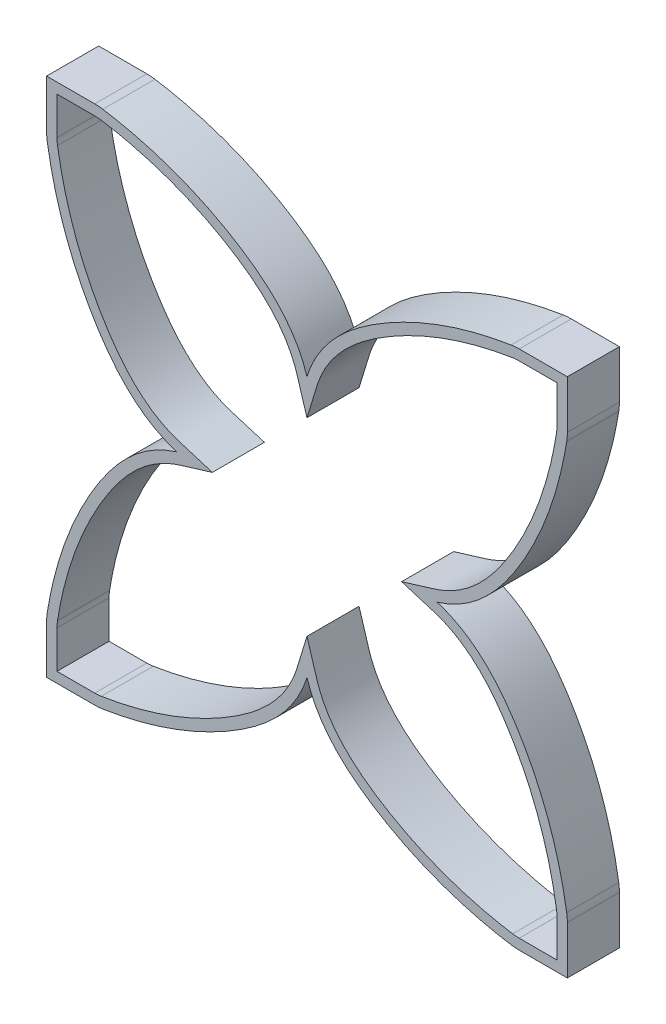
from build123d import *

# Parameters (mm, degrees)
BOSS_EXTRUDE1_DEPTH = 10


with BuildPart() as part:
    # Sketch1 → Boss-Extrude1 (new body)
    with BuildSketch(Plane.XY):
        with BuildLine():
            Line((0, 0), (0, -9.242053945))
            ThreePointArc((0, -9.242053945), (0.030694057, -10.024958163), (0.122587803, -10.80305628))
            add(Edge.make_bspline(
                [(0.122587803, -10.80305628), (0.685908358, -14.367528415), (2.7114907, -23.140292662), (9.284416492, -37.987291491), (17.801165023, -47.794657347), (25, -50)],
                knots=[0.016475851, 0.016475851, 0.016475851, 0.016475851, 0.236061139, 0.56358454, 1, 1, 1, 1], degree=3))
            add(Edge.make_bspline(
                [(0.122587803, -89.19694372), (0.685908358, -85.632471585), (2.7114907, -76.859707338), (9.284416492, -62.012708509), (17.801165023, -52.205342653), (25, -50)],
                knots=[0.016475851, 0.016475851, 0.016475851, 0.016475851, 0.236061139, 0.56358454, 1, 1, 1, 1], degree=3))
            ThreePointArc((0.122587803, -89.19694372), (0.030694057, -89.975041837), (0, -90.757946055))
            Line((0, -90.757946055), (0, -100))
            Line((0, -100), (9.242053945, -100))
            ThreePointArc((9.242053945, -100), (10.024958163, -99.969305943), (10.80305628, -99.877412197))
            add(Edge.make_bspline(
                [(10.80305628, -99.877412197), (14.367528415, -99.314091642), (23.140292662, -97.2885093), (37.987291491, -90.715583508), (47.794657347, -82.198834977), (50, -75)],
                knots=[0.016475851, 0.016475851, 0.016475851, 0.016475851, 0.236061139, 0.56358454, 1, 1, 1, 1], degree=3))
            add(Edge.make_bspline(
                [(89.19694372, -99.877412197), (85.632471585, -99.314091642), (76.859707338, -97.2885093), (62.012708509, -90.715583508), (52.205342653, -82.198834977), (50, -75)],
                knots=[0.016475851, 0.016475851, 0.016475851, 0.016475851, 0.236061139, 0.56358454, 1, 1, 1, 1], degree=3))
            ThreePointArc((89.19694372, -99.877412197), (89.975041837, -99.969305943), (90.757946055, -100))
            Line((90.757946055, -100), (100, -100))
            Line((100, -100), (100, -90.757946055))
            ThreePointArc((100, -90.757946055), (99.969305943, -89.975041837), (99.877412197, -89.19694372))
            add(Edge.make_bspline(
                [(99.877412197, -89.19694372), (99.314091642, -85.632471585), (97.2885093, -76.859707338), (90.715583508, -62.012708509), (82.198834977, -52.205342653), (75, -50)],
                knots=[0.016475851, 0.016475851, 0.016475851, 0.016475851, 0.236061139, 0.56358454, 1, 1, 1, 1], degree=3))
            add(Edge.make_bspline(
                [(99.877412197, -10.80305628), (99.314091642, -14.367528415), (97.2885093, -23.140292662), (90.715583508, -37.987291491), (82.198834977, -47.794657347), (75, -50)],
                knots=[0.016475851, 0.016475851, 0.016475851, 0.016475851, 0.236061139, 0.56358454, 1, 1, 1, 1], degree=3))
            ThreePointArc((99.877412197, -10.80305628), (99.969305943, -10.024958163), (100, -9.242053945))
            Line((100, -9.242053945), (100, 0))
            Line((100, 0), (90.757946055, 0))
            ThreePointArc((90.757946055, 0), (89.975041837, -0.030694057), (89.19694372, -0.122587803))
            add(Edge.make_bspline(
                [(89.19694372, -0.122587803), (85.632471585, -0.685908358), (76.859707338, -2.7114907), (62.012708509, -9.284416492), (52.205342653, -17.801165023), (50, -25)],
                knots=[0.016475851, 0.016475851, 0.016475851, 0.016475851, 0.236061139, 0.56358454, 1, 1, 1, 1], degree=3))
            add(Edge.make_bspline(
                [(10.80305628, -0.122587803), (14.367528415, -0.685908358), (23.140292662, -2.7114907), (37.987291491, -9.284416492), (47.794657347, -17.801165023), (50, -25)],
                knots=[0.016475851, 0.016475851, 0.016475851, 0.016475851, 0.236061139, 0.56358454, 1, 1, 1, 1], degree=3))
            ThreePointArc((10.80305628, -0.122587803), (10.024958163, -0.030694057), (9.242053945, 0))
            Line((9.242053945, 0), (0, 0))
        make_face()
        with BuildLine():
            Line((2, -2), (2, -9.242053945))
            ThreePointArc((2, -9.242053945), (2.024555246, -9.868377319), (2.098070242, -10.490855813))
            add(Edge.make_bspline(
                [(2.098070242, -10.490855813), (2.444069582, -12.680204302), (3.331669001, -17.035127547), (5.260019869, -23.389259646), (7.801434381, -29.513351974), (10.983024362, -35.372937491), (14.149232999, -39.905993359), (17.059278881, -43.020986867), (19.451173969, -45.049833404), (21.641453827, -46.441127237), (23.523341165, -47.350065483), (24.64770741, -47.784131695), (25.405341697, -48.033067811), (25.957829229, -48.201321168), (26.970970181, -48.51231476), (28.964189392, -49.122480359), (30.683998781, -49.649532559), (31.828019312, -50)],
                knots=[0.016475851, 0.016475851, 0.016475851, 0.016475851, 0.155183919, 0.293891987, 0.432600055, 0.571308123, 0.710016191, 0.779370225, 0.848724259, 0.918078293, 0.95275531, 0.987432327, 0.996101581, 1.004770835, 1.022109344, 1.056786361, 1.126140395, 1.126140395, 1.126140395, 1.126140395], degree=3))
            add(Edge.make_bspline(
                [(31.828019312, -50), (30.683998781, -50.350467441), (28.964189392, -50.877519641), (26.970970181, -51.48768524), (25.957829229, -51.798678832), (25.405341697, -51.966932189), (24.64770741, -52.215868305), (23.523341165, -52.649934517), (21.641453827, -53.558872763), (19.451173969, -54.950166596), (17.059278881, -56.979013133), (14.149232999, -60.094006641), (10.983024362, -64.627062509), (7.801434381, -70.486648026), (5.260019869, -76.610740354), (3.331669001, -82.964872453), (2.444069582, -87.319795698), (2.098070242, -89.509144187)],
                knots=[0.016475851, 0.016475851, 0.016475851, 0.016475851, 0.085829885, 0.120506902, 0.13784541, 0.146514664, 0.155183919, 0.189860936, 0.224537953, 0.293891987, 0.363246021, 0.432600055, 0.571308123, 0.710016191, 0.848724259, 0.987432327, 1.126140395, 1.126140395, 1.126140395, 1.126140395], degree=3))
            ThreePointArc((2.098070242, -89.509144187), (2.024555246, -90.131622681), (2, -90.757946055))
            Line((2, -90.757946055), (2, -98))
            Line((2, -98), (9.242053945, -98))
            ThreePointArc((9.242053945, -98), (9.868377319, -97.975444754), (10.490855813, -97.901929758))
            add(Edge.make_bspline(
                [(10.490855813, -97.901929758), (12.680204302, -97.555930418), (17.035127547, -96.668330999), (23.389259646, -94.739980131), (29.513351974, -92.198565619), (35.372937491, -89.016975638), (39.905993359, -85.850767001), (43.020986867, -82.940721119), (45.049833404, -80.548826031), (46.441127237, -78.358546173), (47.350065483, -76.476658835), (47.784131695, -75.35229259), (48.033067811, -74.594658303), (48.201321168, -74.042170771), (48.51231476, -73.029029819), (49.122480359, -71.035810608), (49.649532559, -69.316001219), (50, -68.171980688)],
                knots=[0.016475851, 0.016475851, 0.016475851, 0.016475851, 0.155183919, 0.293891987, 0.432600055, 0.571308123, 0.710016191, 0.779370225, 0.848724259, 0.918078293, 0.95275531, 0.987432327, 0.996101581, 1.004770835, 1.022109344, 1.056786361, 1.126140395, 1.126140395, 1.126140395, 1.126140395], degree=3))
            add(Edge.make_bspline(
                [(50, -68.171980688), (50.350467441, -69.316001219), (50.877519641, -71.035810608), (51.48768524, -73.029029819), (51.798678832, -74.042170771), (51.966932189, -74.594658303), (52.215868305, -75.35229259), (52.649934517, -76.476658835), (53.558872763, -78.358546173), (54.950166596, -80.548826031), (56.979013133, -82.940721119), (60.094006641, -85.850767001), (64.627062509, -89.016975638), (70.486648026, -92.198565619), (76.610740354, -94.739980131), (82.964872453, -96.668330999), (87.319795698, -97.555930418), (89.509144187, -97.901929758)],
                knots=[0.016475851, 0.016475851, 0.016475851, 0.016475851, 0.085829885, 0.120506902, 0.13784541, 0.146514664, 0.155183919, 0.189860936, 0.224537953, 0.293891987, 0.363246021, 0.432600055, 0.571308123, 0.710016191, 0.848724259, 0.987432327, 1.126140395, 1.126140395, 1.126140395, 1.126140395], degree=3))
            ThreePointArc((89.509144187, -97.901929758), (90.131622681, -97.975444754), (90.757946055, -98))
            Line((90.757946055, -98), (98, -98))
            Line((98, -98), (98, -90.757946055))
            ThreePointArc((98, -90.757946055), (97.975444754, -90.131622681), (97.901929758, -89.509144187))
            add(Edge.make_bspline(
                [(97.901929758, -89.509144187), (97.555930418, -87.319795698), (96.668330999, -82.964872453), (94.739980131, -76.610740354), (92.198565619, -70.486648026), (89.016975638, -64.627062509), (85.850767001, -60.094006641), (82.940721119, -56.979013133), (80.548826031, -54.950166596), (78.358546173, -53.558872763), (76.476658835, -52.649934517), (75.35229259, -52.215868305), (74.594658303, -51.966932189), (74.042170771, -51.798678832), (73.029029819, -51.48768524), (71.035810608, -50.877519641), (69.316001219, -50.350467441), (68.171980688, -50)],
                knots=[0.016475851, 0.016475851, 0.016475851, 0.016475851, 0.155183919, 0.293891987, 0.432600055, 0.571308123, 0.710016191, 0.779370225, 0.848724259, 0.918078293, 0.95275531, 0.987432327, 0.996101581, 1.004770835, 1.022109344, 1.056786361, 1.126140395, 1.126140395, 1.126140395, 1.126140395], degree=3))
            add(Edge.make_bspline(
                [(68.171980688, -50), (69.316001219, -49.649532559), (71.035810608, -49.122480359), (73.029029819, -48.51231476), (74.042170771, -48.201321168), (74.594658303, -48.033067811), (75.35229259, -47.784131695), (76.476658835, -47.350065483), (78.358546173, -46.441127237), (80.548826031, -45.049833404), (82.940721119, -43.020986867), (85.850767001, -39.905993359), (89.016975638, -35.372937491), (92.198565619, -29.513351974), (94.739980131, -23.389259646), (96.668330999, -17.035127547), (97.555930418, -12.680204302), (97.901929758, -10.490855813)],
                knots=[0.016475851, 0.016475851, 0.016475851, 0.016475851, 0.085829885, 0.120506902, 0.13784541, 0.146514664, 0.155183919, 0.189860936, 0.224537953, 0.293891987, 0.363246021, 0.432600055, 0.571308123, 0.710016191, 0.848724259, 0.987432327, 1.126140395, 1.126140395, 1.126140395, 1.126140395], degree=3))
            ThreePointArc((97.901929758, -10.490855813), (97.975444754, -9.868377319), (98, -9.242053945))
            Line((98, -9.242053945), (98, -2))
            Line((98, -2), (90.757946055, -2))
            ThreePointArc((90.757946055, -2), (90.131622681, -2.024555246), (89.509144187, -2.098070242))
            add(Edge.make_bspline(
                [(89.509144187, -2.098070242), (87.319795698, -2.444069582), (82.964872453, -3.331669001), (76.610740354, -5.260019869), (70.486648026, -7.801434381), (64.627062509, -10.983024362), (60.094006641, -14.149232999), (56.979013133, -17.059278881), (54.950166596, -19.451173969), (53.558872763, -21.641453827), (52.649934517, -23.523341165), (52.215868305, -24.64770741), (51.966932189, -25.405341697), (51.798678832, -25.957829229), (51.48768524, -26.970970181), (50.877519641, -28.964189392), (50.350467441, -30.683998781), (50, -31.828019312)],
                knots=[0.016475851, 0.016475851, 0.016475851, 0.016475851, 0.155183919, 0.293891987, 0.432600055, 0.571308123, 0.710016191, 0.779370225, 0.848724259, 0.918078293, 0.95275531, 0.987432327, 0.996101581, 1.004770835, 1.022109344, 1.056786361, 1.126140395, 1.126140395, 1.126140395, 1.126140395], degree=3))
            add(Edge.make_bspline(
                [(50, -31.828019312), (49.649532559, -30.683998781), (49.122480359, -28.964189392), (48.51231476, -26.970970181), (48.201321168, -25.957829229), (48.033067811, -25.405341697), (47.784131695, -24.64770741), (47.350065483, -23.523341165), (46.441127237, -21.641453827), (45.049833404, -19.451173969), (43.020986867, -17.059278881), (39.905993359, -14.149232999), (35.372937491, -10.983024362), (29.513351974, -7.801434381), (23.389259646, -5.260019869), (17.035127547, -3.331669001), (12.680204302, -2.444069582), (10.490855813, -2.098070242)],
                knots=[0.016475851, 0.016475851, 0.016475851, 0.016475851, 0.085829885, 0.120506902, 0.13784541, 0.146514664, 0.155183919, 0.189860936, 0.224537953, 0.293891987, 0.363246021, 0.432600055, 0.571308123, 0.710016191, 0.848724259, 0.987432327, 1.126140395, 1.126140395, 1.126140395, 1.126140395], degree=3))
            ThreePointArc((10.490855813, -2.098070242), (9.868377319, -2.024555246), (9.242053945, -2))
            Line((9.242053945, -2), (2, -2))
        make_face(mode=Mode.SUBTRACT)
    extrude(amount=BOSS_EXTRUDE1_DEPTH)


solid = part.part
